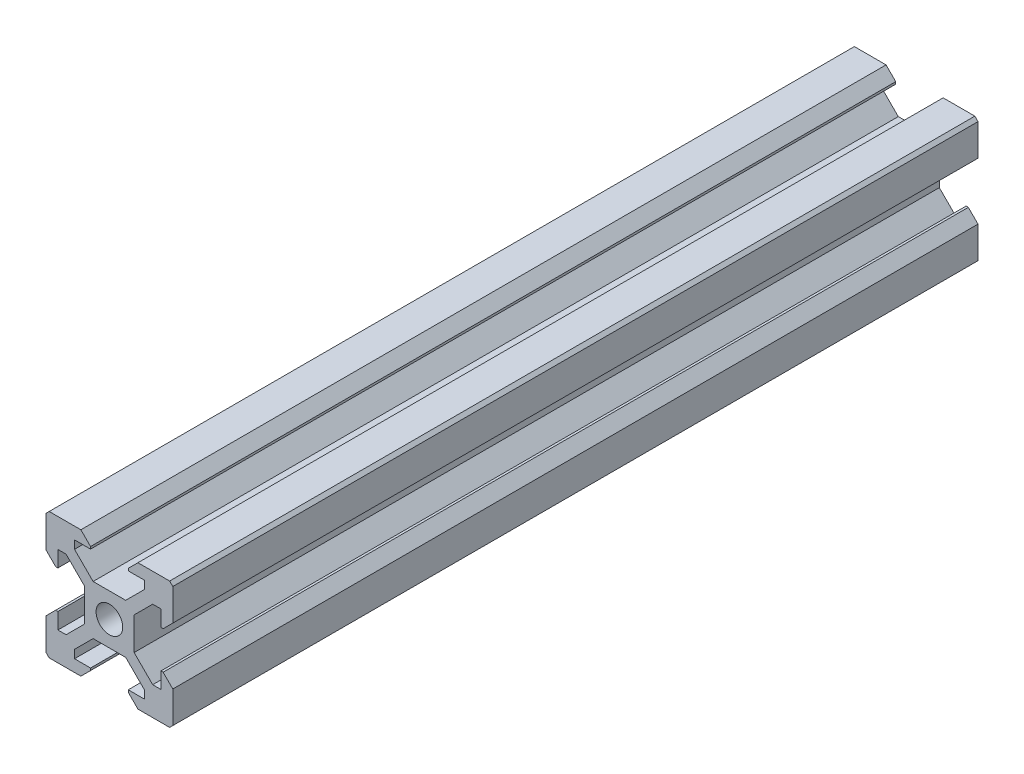
from build123d import *

# Parameters (mm, degrees)
BOSS_EXTRUDE1_DEPTH = 127
CHAMFER2_SIZE       = 0.5
CHAMFER2_SIZE2      = 0.353553391
CHAMFER1_SIZE       = 0.5


with BuildPart() as part:
    # Sketch1 → Boss-Extrude1 (new body)
    with BuildSketch(Plane.XY):
        with BuildLine():
            Line((5.5, 6.829360749), (2.570639251, 3.9))
            Line((2.570639251, 3.9), (0, 3.9))
            Line((0, 3.9), (0, 2.1))
            ThreePointArc((0, 2.1), (0.803635208, 1.940147018), (1.48492424, 1.48492424))
            Line((1.48492424, 1.48492424), (10, 10))
            Line((10, 10), (4.5, 10))
            Line((4.5, 10), (2.62, 8.12))
            Line((2.62, 8.12), (5.5, 8.12))
            Line((5.5, 8.12), (5.5, 6.829360749))
        make_face()
    extrude(amount=BOSS_EXTRUDE1_DEPTH)

    # Chamfer2
    chamfer2_edges = [part.edges().sort_by_distance(p)[0] for p in [
        (2.62, 8.12, 63.5),
    ]]
    chamfer2_side = [part.faces().sort_by_distance(p)[0] for p in [
        (3.56, 9.06, 63.5),
    ]]
    chamfer(chamfer2_edges, length=CHAMFER2_SIZE, length2=CHAMFER2_SIZE2, reference=chamfer2_side[0])

    # Mirror1: part across plane


with BuildPart() as part_1:
    add(part.part)
    add(part.part.mirror(Plane(origin=(10, 10, 127), x_dir=(0, 0, 1), z_dir=(-0.707106781186544, 0.7071067811865511, 0))))

    # Chamfer1
    chamfer1_edges = [part_1.edges().sort_by_distance(p)[0] for p in [
        (10, 10, 63.5),
    ]]
    chamfer(chamfer1_edges, length=CHAMFER1_SIZE)

    # Mirror4: part across plane


with BuildPart() as part_2:
    add(part_1.part)
    add(part_1.part.mirror(Plane(origin=(0, 3.9, 127), x_dir=(0, 0, 1), z_dir=(1, 0, 0))))

    # Mirror5: part across plane


with BuildPart() as part_3:
    add(part_2.part)
    add(part_2.part.mirror(Plane(origin=(-3.9, 0, 127), x_dir=(0, 0, 1), z_dir=(0, 1, 0))))


solid = part_3.part
